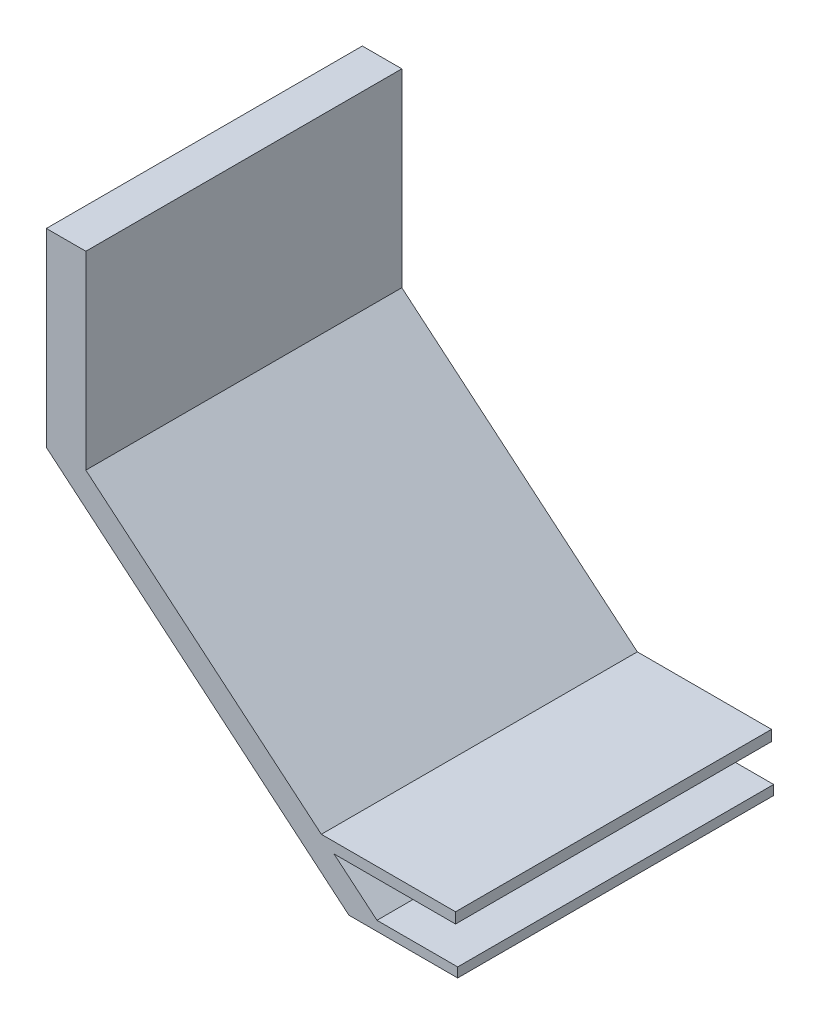
from build123d import *

# Parameters (mm, degrees)
SKETCH1_W           = 25
SKETCH1_H           = 120
BOSS_EXTRUDE4_DEPTH = 200


with BuildPart() as part:
    # Sketch1 → Boss-Extrude4 (new body)
    with BuildSketch(Plane.XY):
        with Locations((-12.5, -60)):
            Rectangle(SKETCH1_W, SKETCH1_H)
        Polygon((-25, -120), (0, -120), (191.51111078, -280.696902422), (166.51111078, -280.696902422), align=None)
        Polygon((233.990264512, -245.068874008), (149.051279921, -245.068874008), (157.072044946, -251.799094983), (233.990264512, -251.799094983), align=None)
        Polygon((191.51111078, -280.696902422), (235.34462255, -280.696902422), (235.34462255, -274.614068302), (184.261871365, -274.614068302), align=None)
    extrude(amount=BOSS_EXTRUDE4_DEPTH)


solid = part.part
